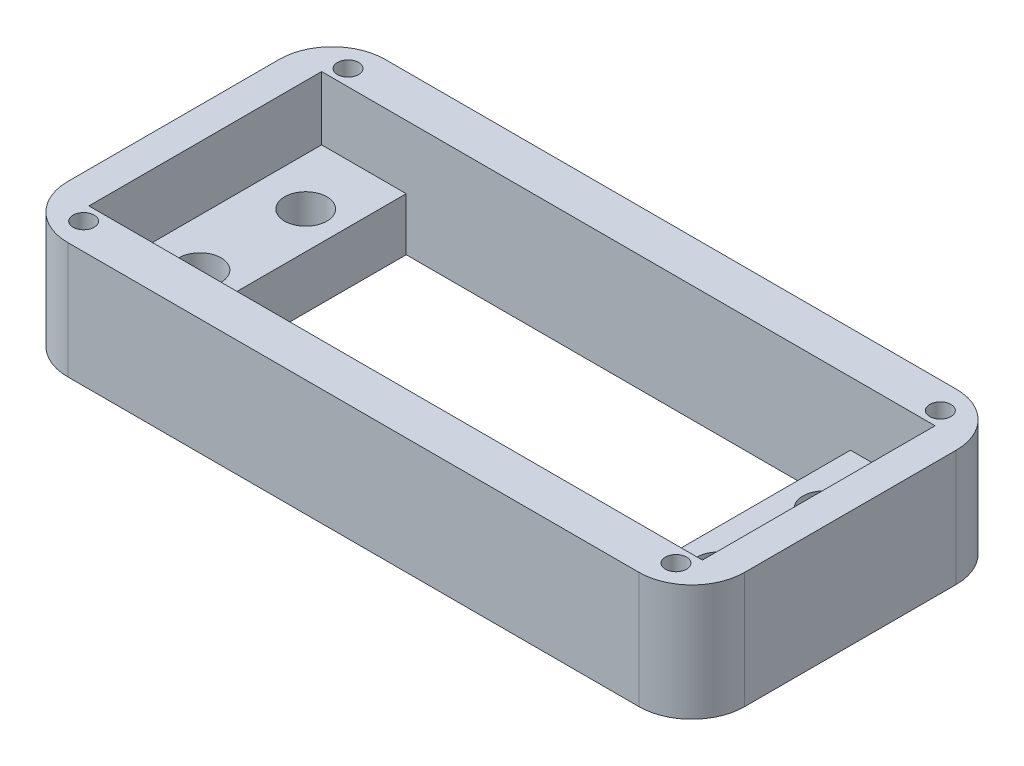
from build123d import *

# Parameters (mm, degrees)
SKETCH2_W           = 64
SKETCH2_H           = 30
BOSS_EXTRUDE1_DEPTH = 64
CUT_EXTRUDE1_REACH  = 97.352
SKETCH3_W           = 42
SKETCH3_H           = 22
CUT_EXTRUDE2_REACH  = 97.352
SKETCH4_R           = 2
SKETCH5_W           = 64
SKETCH5_H           = 30
SKETCH5_W_2         = 58
SKETCH5_H_2         = 22
BOSS_EXTRUDE2_DEPTH = 12
CUT_EXTRUDE3_REACH  = 105.788
SKETCH6_R           = 1
FILLET1_R           = 5
CUT_EXTRUDE4_DEPTH  = 59
CUT_EXTRUDE7_DEPTH  = 6


with BuildPart() as part:
    # Sketch2 → Boss-Extrude1 (new body)
    with BuildSketch(Plane(origin=(0, 0, 0), x_dir=(1, 0, 0), z_dir=(0, 1, 0))):
        with Locations((32, 15)):
            Rectangle(SKETCH2_W, SKETCH2_H)
    extrude(amount=BOSS_EXTRUDE1_DEPTH)

    # Sketch3 → Cut-Extrude1 (cut, up to next)
    with BuildSketch(Plane(origin=(0, 64, 0), x_dir=(1, 0, 0), z_dir=(0, 1, 0)), mode=Mode.PRIVATE) as cut_extrude1_sk1:
        with Locations((32, 15)):
            Rectangle(SKETCH3_W, SKETCH3_H)
    cut_extrude1_tool1 = extrude(cut_extrude1_sk1.sketch, amount=-CUT_EXTRUDE1_REACH, mode=Mode.PRIVATE) & part.part
    add(cut_extrude1_tool1.solids().sort_by_distance((32, 64, -15))[0], mode=Mode.SUBTRACT)

    # Sketch4 → Cut-Extrude2 (cut, up to next)
    with BuildSketch(Plane(origin=(0, 64, 0), x_dir=(1, 0, 0), z_dir=(0, 1, 0)), mode=Mode.PRIVATE) as cut_extrude2_sk1:
        with Locations(Location((7.5, 20, 0), (0, 0, 270))):
            Circle(SKETCH4_R)
    cut_extrude2_tool1 = extrude(cut_extrude2_sk1.sketch, amount=-CUT_EXTRUDE2_REACH, mode=Mode.PRIVATE) & part.part
    # Sketch4 → Cut-Extrude2 (cut, up to next)
    with BuildSketch(Plane(origin=(0, 64, 0), x_dir=(1, 0, 0), z_dir=(0, 1, 0)), mode=Mode.PRIVATE) as cut_extrude2_sk2:
        with Locations(Location((7.5, 10, 0), (0, 0, 90))):
            Circle(SKETCH4_R)
    cut_extrude2_tool2 = extrude(cut_extrude2_sk2.sketch, amount=-CUT_EXTRUDE2_REACH, mode=Mode.PRIVATE) & part.part
    # Sketch4 → Cut-Extrude2 (cut, up to next)
    with BuildSketch(Plane(origin=(0, 64, 0), x_dir=(1, 0, 0), z_dir=(0, 1, 0)), mode=Mode.PRIVATE) as cut_extrude2_sk3:
        with Locations(Location((56.5, 10, 0), (0, 0, 270))):
            Circle(SKETCH4_R)
    cut_extrude2_tool3 = extrude(cut_extrude2_sk3.sketch, amount=-CUT_EXTRUDE2_REACH, mode=Mode.PRIVATE) & part.part
    # Sketch4 → Cut-Extrude2 (cut, up to next)
    with BuildSketch(Plane(origin=(0, 64, 0), x_dir=(1, 0, 0), z_dir=(0, 1, 0)), mode=Mode.PRIVATE) as cut_extrude2_sk4:
        with Locations(Location((56.5, 20, 0), (0, 0, 90))):
            Circle(SKETCH4_R)
    cut_extrude2_tool4 = extrude(cut_extrude2_sk4.sketch, amount=-CUT_EXTRUDE2_REACH, mode=Mode.PRIVATE) & part.part
    add(cut_extrude2_tool1.solids().sort_by_distance((7.5, 64, -20))[0], mode=Mode.SUBTRACT)
    add(cut_extrude2_tool2.solids().sort_by_distance((7.5, 64, -10))[0], mode=Mode.SUBTRACT)
    add(cut_extrude2_tool3.solids().sort_by_distance((56.5, 64, -10))[0], mode=Mode.SUBTRACT)
    add(cut_extrude2_tool4.solids().sort_by_distance((56.5, 64, -20))[0], mode=Mode.SUBTRACT)

    # Sketch5 → Boss-Extrude2 (add)
    with BuildSketch(Plane(origin=(0, 64, 0), x_dir=(1, 0, 0), z_dir=(0, 1, 0))):
        with Locations((32, 15)):
            Rectangle(SKETCH5_W, SKETCH5_H)
        with Locations((32, 15)):
            Rectangle(SKETCH5_W_2, SKETCH5_H_2, mode=Mode.SUBTRACT)
    extrude(amount=BOSS_EXTRUDE2_DEPTH)

    # Sketch6 → Cut-Extrude3 (cut, up to next)
    with BuildSketch(Plane(origin=(0, 76, 0), x_dir=(1, 0, 0), z_dir=(0, 1, 0)), mode=Mode.PRIVATE) as cut_extrude3_sk1:
        with Locations(Location((4, 27.5, 0), (0, 0, 270))):
            Circle(SKETCH6_R)
    cut_extrude3_tool1 = extrude(cut_extrude3_sk1.sketch, amount=-CUT_EXTRUDE3_REACH, mode=Mode.PRIVATE) & part.part
    # Sketch6 → Cut-Extrude3 (cut, up to next)
    with BuildSketch(Plane(origin=(0, 76, 0), x_dir=(1, 0, 0), z_dir=(0, 1, 0)), mode=Mode.PRIVATE) as cut_extrude3_sk2:
        with Locations(Location((4, 2.5, 0), (0, 0, 90))):
            Circle(SKETCH6_R)
    cut_extrude3_tool2 = extrude(cut_extrude3_sk2.sketch, amount=-CUT_EXTRUDE3_REACH, mode=Mode.PRIVATE) & part.part
    # Sketch6 → Cut-Extrude3 (cut, up to next)
    with BuildSketch(Plane(origin=(0, 76, 0), x_dir=(1, 0, 0), z_dir=(0, 1, 0)), mode=Mode.PRIVATE) as cut_extrude3_sk3:
        with Locations(Location((60, 2.5, 0), (0, 0, 270))):
            Circle(SKETCH6_R)
    cut_extrude3_tool3 = extrude(cut_extrude3_sk3.sketch, amount=-CUT_EXTRUDE3_REACH, mode=Mode.PRIVATE) & part.part
    # Sketch6 → Cut-Extrude3 (cut, up to next)
    with BuildSketch(Plane(origin=(0, 76, 0), x_dir=(1, 0, 0), z_dir=(0, 1, 0)), mode=Mode.PRIVATE) as cut_extrude3_sk4:
        with Locations(Location((60, 27.5, 0), (0, 0, 90))):
            Circle(SKETCH6_R)
    cut_extrude3_tool4 = extrude(cut_extrude3_sk4.sketch, amount=-CUT_EXTRUDE3_REACH, mode=Mode.PRIVATE) & part.part
    add(cut_extrude3_tool1.solids().sort_by_distance((4, 76, -27.5))[0], mode=Mode.SUBTRACT)
    add(cut_extrude3_tool2.solids().sort_by_distance((4, 76, -2.5))[0], mode=Mode.SUBTRACT)
    add(cut_extrude3_tool3.solids().sort_by_distance((60, 76, -2.5))[0], mode=Mode.SUBTRACT)
    add(cut_extrude3_tool4.solids().sort_by_distance((60, 76, -27.5))[0], mode=Mode.SUBTRACT)

    # Fillet1
    fillet1_edges = [part.edges().sort_by_distance(p)[0] for p in [
        (0, 38, -30),
        (64, 38, -30),
        (64, 38, 0),
        (0, 38, 0),
    ]]
    fillet(fillet1_edges, radius=FILLET1_R)

    # Sketch7 → Cut-Extrude4 (cut)
    with BuildSketch(Plane.XZ):
        with BuildLine():
            Line((5, -30), (59, -30))
            ThreePointArc((59, -30), (62.535533906, -28.535533906), (64, -25))
            Line((64, -25), (64, -5))
            ThreePointArc((64, -5), (62.535533906, -1.464466094), (59, 0))
            Line((59, 0), (5, 0))
            ThreePointArc((5, 0), (1.464466094, -1.464466094), (0, -5))
            Line((0, -5), (0, -25))
            ThreePointArc((0, -25), (1.464466094, -28.535533906), (5, -30))
        make_face()
    extrude(amount=-CUT_EXTRUDE4_DEPTH, mode=Mode.SUBTRACT)

    # Sketch10 → Cut-Extrude7 (cut)
    with BuildSketch(Plane(origin=(0, 76, 0), x_dir=(1, 0, 0), z_dir=(0, 1, 0))):
        with BuildLine():
            Line((64, 5), (64, 25))
            ThreePointArc((64, 25), (62.535533906, 28.535533906), (59, 30))
            Line((59, 30), (5, 30))
            ThreePointArc((5, 30), (1.464466094, 28.535533906), (0, 25))
            Line((0, 25), (0, 5))
            ThreePointArc((0, 5), (1.464466094, 1.464466094), (5, 0))
            Line((5, 0), (59, 0))
            ThreePointArc((59, 0), (62.535533906, 1.464466094), (64, 5))
        make_face()
    extrude(amount=-CUT_EXTRUDE7_DEPTH, mode=Mode.SUBTRACT)


solid = part.part
